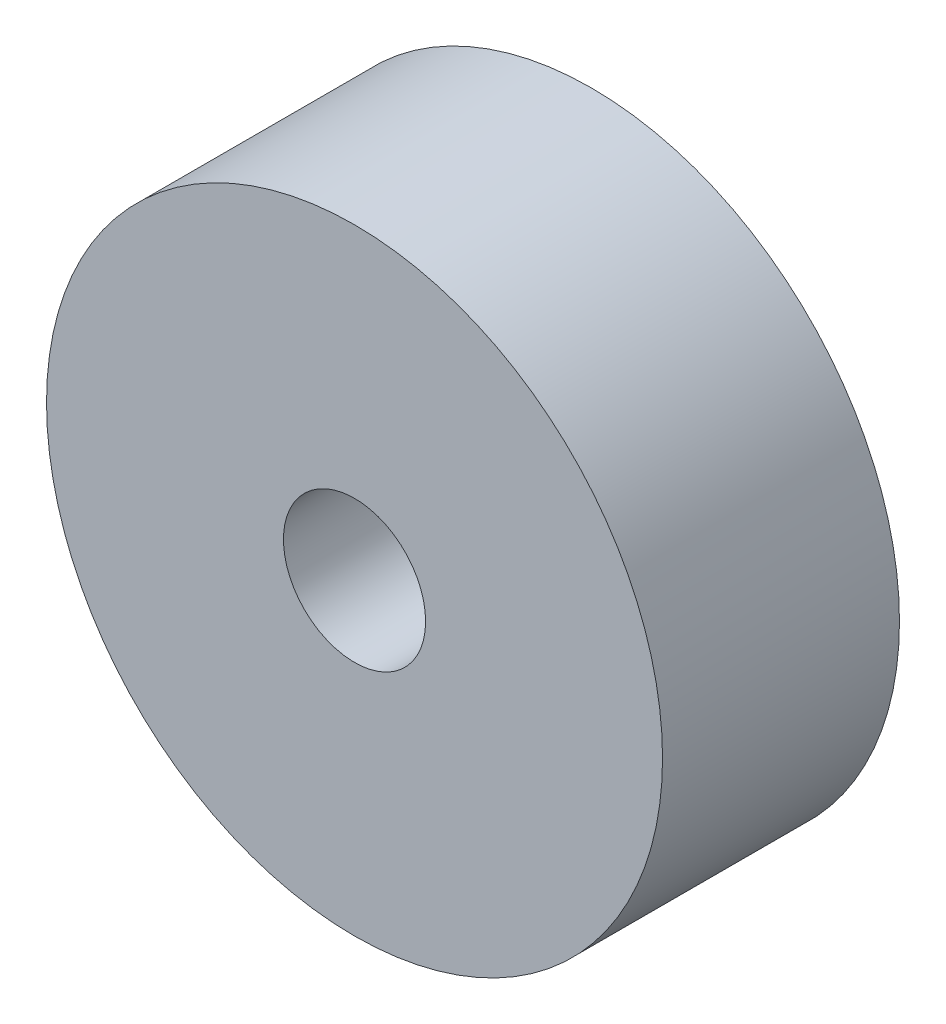
from build123d import *

# Parameters (mm, degrees)
SKETCH_1_R      = 6.5
SKETCH_1_R_2    = 1.5
EXTRUDE_1_DEPTH = 5


with BuildPart() as part:
    # 草图1 → 凸台-拉伸1 (new body)
    with BuildSketch(Plane.XY):
        Circle(SKETCH_1_R)
        Circle(SKETCH_1_R_2, mode=Mode.SUBTRACT)
    extrude(amount=EXTRUDE_1_DEPTH)


solid = part.part
